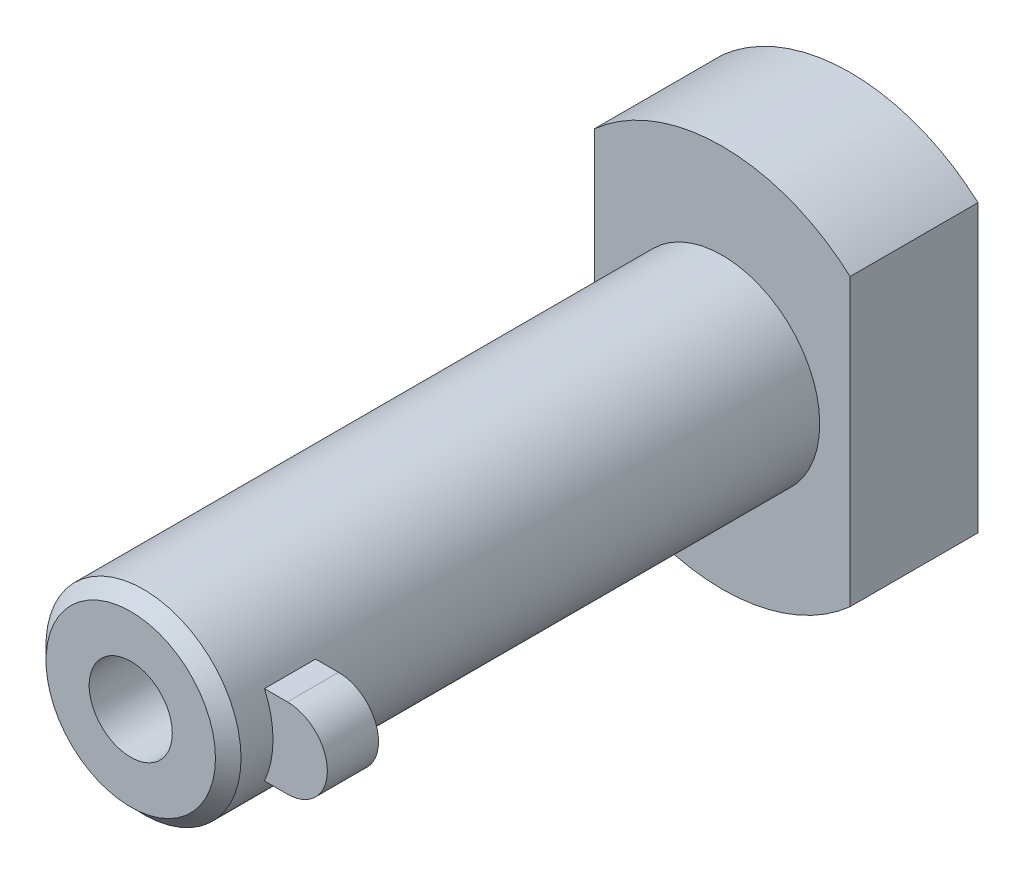
from build123d import *

# Parameters (mm, degrees)
AUFSATZ_LINEAR_AUSTRAGEN1_DEPTH = 4
SKIZZE2_R                       = 3.05
AUFSATZ_LINEAR_AUSTRAGEN2_DEPTH = 18.5
AUFSATZ_LINEAR_START            = 15.5
AUFSATZ_LINEAR_AUSTRAGEN3_DEPTH = 1.6
SCHNITT_LINEAR_AUSTRAGEN1_REACH = 25.766
SKIZZE4_R                       = 1.3
FASE1_SIZE                      = 0.4


with BuildPart() as part:
    # Skizze1 → Aufsatz-Linear austragen1 (new body)
    with BuildSketch(Plane.XY):
        with BuildLine():
            Line((-4, 4.472135955), (-4, -4.472135955))
            ThreePointArc((-4, -4.472135955), (0, -6), (4, -4.472135955))
            Line((4, -4.472135955), (4, 4.472135955))
            ThreePointArc((4, 4.472135955), (0, 6), (-4, 4.472135955))
        make_face()
    extrude(amount=AUFSATZ_LINEAR_AUSTRAGEN1_DEPTH)

    # Skizze2 → Aufsatz-Linear austragen2 (add)
    with BuildSketch(Plane.XY.offset(4)):
        Circle(SKIZZE2_R)
    extrude(amount=AUFSATZ_LINEAR_AUSTRAGEN2_DEPTH)

    # Skizze3 → Aufsatz-Linear austragen3 (add)
    with BuildSketch(Plane.XY.offset(4).offset(AUFSATZ_LINEAR_START)):
        with BuildLine():
            Line((3.5, 1.25), (2.782085549, 1.25))
            ThreePointArc((2.782085549, 1.25), (2.982269348, 0.639194445), (3.05, 0))
            ThreePointArc((3.05, 0), (2.982269348, -0.639194445), (2.782085549, -1.25))
            Line((2.782085549, -1.25), (3.5, -1.25))
            ThreePointArc((3.5, -1.25), (4.75, 0), (3.5, 1.25))
        make_face()
    extrude(amount=AUFSATZ_LINEAR_AUSTRAGEN3_DEPTH)

    # Skizze4 → Schnitt-Linear austragen1 (cut, up to next)
    with BuildSketch(Plane.XY.offset(22.5), mode=Mode.PRIVATE) as schnitt_linear_austragen1_sk1:
        Circle(SKIZZE4_R)
    schnitt_linear_austragen1_tool1 = extrude(schnitt_linear_austragen1_sk1.sketch, amount=-SCHNITT_LINEAR_AUSTRAGEN1_REACH, mode=Mode.PRIVATE) & part.part
    add(schnitt_linear_austragen1_tool1.solids().sort_by_distance((0, 0, 22.5))[0], mode=Mode.SUBTRACT)

    # Fase1
    fase1_edges = [part.edges().sort_by_distance(p)[0] for p in [
        (-3.05, 0, 22.5),
    ]]
    chamfer(fase1_edges, length=FASE1_SIZE)


solid = part.part
